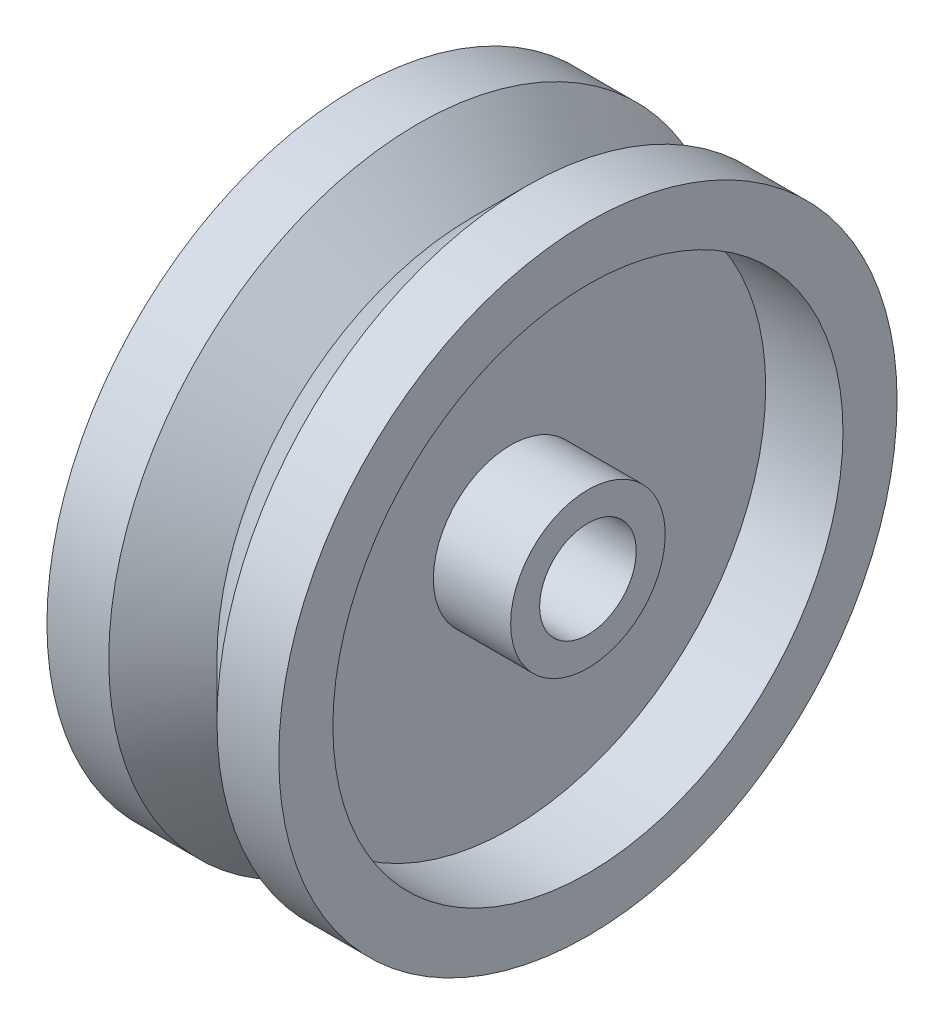
from build123d import *


with BuildPart() as part:
    # Sketch1 → Revolve1 (revolve)
    with BuildSketch(Plane(origin=(0, 0, 0), x_dir=(1, 0, 0), z_dir=(0, 1, 0)), mode=Mode.PRIVATE) as revolve1_sk:
        Polygon((-7.5, 3.125), (7.5, 3.125), (7.5, 5), (2.5, 5), (2.5, 16.5), (7.5, 16.5), (7.5, 20), (3.5, 20), (0, 16.5), (-3.5, 20), (-7.5, 20), (-7.5, 16.5), (-2.5, 16.5), (-2.5, 5), (-7.5, 5), align=None)
    revolve(revolve1_sk.sketch.rotate(Axis((-45.043103448, 0, 0), (1, 0, 0)), 180), axis=Axis((-45.043103448, 0, 0), (1, 0, 0)))


solid = part.part
